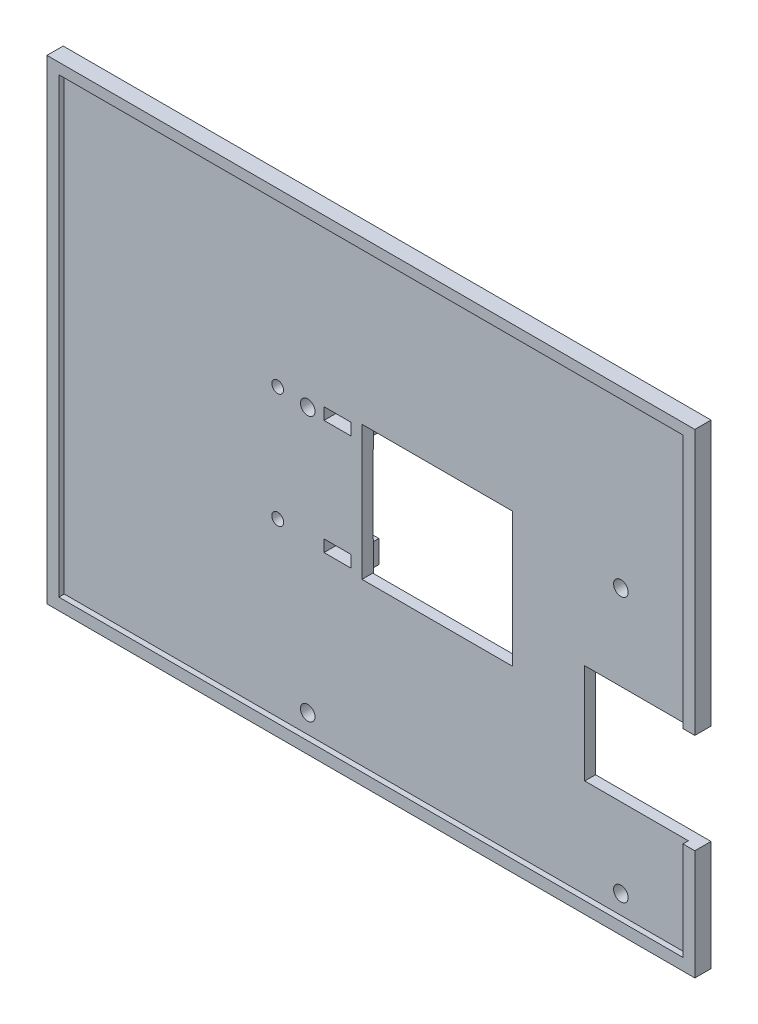
from build123d import *

# Parameters (mm, degrees)
SKETCH_1_W          = 120
SKETCH_1_H          = 80
EXTRUDE_1_DEPTH     = 38
SKETCH_3_W          = 117.6
SKETCH_3_H          = 77.6
CUT_EXTRUDE_1_DEPTH = 36
SKETCH_4_W          = 25.152970524
SKETCH_4_H          = 18.492901276
CUT_EXTRUDE_2_DEPTH = 10
SKETCH_7_W          = 17.413678367
SKETCH_7_H          = 5.076618726
SKETCH_7_H_2        = 5.541721388
EXTRUDE_2_DEPTH     = 0.1
SKETCH_9_W          = 27.882777132
SKETCH_9_H          = 24.878568111
CUT_EXTRUDE_4_DEPTH = 12
SKETCH_12_R         = 1.085209003
SKETCH_12_R_2       = 1.1
SKETCH_12_W         = 5.025
SKETCH_12_H         = 2.2
CUT_EXTRUDE_5_DEPTH = 12
SKETCH_13_R         = 1.35
CUT_EXTRUDE_6_DEPTH = 12
SKETCH_14_W         = 117.6
SKETCH_14_H         = 36
CUT_EXTRUDE_7_DEPTH = 10
EXTRUDE_3_DEPTH     = 5
SKETCH_16_W         = 120
SKETCH_16_H         = 38
EXTRUDE_4_DEPTH     = 2
SKETCH_17_W         = 36
SKETCH_17_H         = 83.8
EXTRUDE_5_DEPTH     = 1
EXTRUDE_6_DEPTH     = 1
SKETCH_19_W         = 120
SKETCH_19_H         = 38
EXTRUDE_7_DEPTH     = 1
EXTRUDE_START       = 2
SKETCH_20_R         = 2
SKETCH_20_R_2       = 1.085209003
SKETCH_20_R_3       = 2.001649737
SKETCH_20_R_4       = 1.1
SKETCH_20_W         = 7.2
SKETCH_20_H         = 4.2
SKETCH_20_W_2       = 5.025
SKETCH_20_H_2       = 2.2
EXTRUDE_8_DEPTH     = 2
SKETCH_22_W         = 120
SKETCH_22_H         = 88
CUT_EXTRUDE_8_DEPTH = 35


with BuildPart() as part:
    # 草图1 → 凸台-拉伸1 (new body)
    with BuildSketch(Plane.XY):
        with Locations((-463.106796117, 303.186737633)):
            Rectangle(SKETCH_1_W, SKETCH_1_H)
    extrude(amount=EXTRUDE_1_DEPTH)

    # 草图3 → 切除-拉伸1 (cut)
    with BuildSketch(Plane.XY.offset(38)):
        with Locations((-463.106796117, 303.186737633)):
            Rectangle(SKETCH_3_W, SKETCH_3_H)
    extrude(amount=-CUT_EXTRUDE_1_DEPTH, mode=Mode.SUBTRACT)

    # 草图4 → 切除-拉伸2 (cut)
    with BuildSketch(Plane(origin=(0, 0, 0), x_dir=(-1, 0, 0), z_dir=(0, 0, -1))):
        with Locations((411.924701676, 291.841861287)):
            Rectangle(SKETCH_4_W, SKETCH_4_H)
    extrude(amount=-CUT_EXTRUDE_2_DEPTH, mode=Mode.SUBTRACT)

    # 草图7 → 凸台-拉伸2 (add)
    with BuildSketch(Plane(origin=(0, 0, 0), x_dir=(-1, 0, 0), z_dir=(0, 0, -1))):
        with Locations((474.461956934, 316.64842827)):
            Rectangle(SKETCH_7_W, SKETCH_7_H)
        with Locations((474.461956934, 296.957598327)):
            Rectangle(SKETCH_7_W, SKETCH_7_H_2)
    extrude(amount=EXTRUDE_2_DEPTH)

    # 草图9 → 切除-拉伸4 (cut)
    with BuildSketch(Plane(origin=(0, 0, 0), x_dir=(-1, 0, 0), z_dir=(0, 0, -1))):
        with Locations((451.813729184, 306.747453577)):
            Rectangle(SKETCH_9_W, SKETCH_9_H)
    extrude(amount=-CUT_EXTRUDE_4_DEPTH, mode=Mode.SUBTRACT)

    # 草图12 → 切除-拉伸5 (cut)
    with BuildSketch(Plane(origin=(0, 0, -0.1), x_dir=(-1, 0, 0), z_dir=(0, 0, -1))):
        with Locations((481.368796117, 317.386737633)):
            Circle(SKETCH_12_R)
        with Locations((481.368796117, 296.186737633)):
            Circle(SKETCH_12_R_2)
        with Locations((470.281296117, 317.386737633)):
            Rectangle(SKETCH_12_W, SKETCH_12_H)
        with Locations((470.281296117, 296.186737633)):
            Rectangle(SKETCH_12_W, SKETCH_12_H)
    extrude(amount=-CUT_EXTRUDE_5_DEPTH, mode=Mode.SUBTRACT)

    # 草图13 → 切除-拉伸6 (cut)
    with BuildSketch(Plane.XY.offset(2)):
        with Locations((-475.806796117, 316.886737633)):
            Circle(SKETCH_13_R)
        with Locations((-417.806796117, 316.886737633)):
            Circle(SKETCH_13_R)
        with Locations((-417.806796117, 267.886737633)):
            Circle(SKETCH_13_R)
        with Locations((-475.806796117, 267.886737633)):
            Circle(SKETCH_13_R)
    extrude(amount=-CUT_EXTRUDE_6_DEPTH, mode=Mode.SUBTRACT)

    # 草图14 → 切除-拉伸7 (cut)
    with BuildSketch(Plane.XZ.offset(-341.986737633)):
        with Locations((-463.106796117, 20)):
            Rectangle(SKETCH_14_W, SKETCH_14_H)
    extrude(amount=-CUT_EXTRUDE_7_DEPTH, mode=Mode.SUBTRACT)

    # 草图15 → 凸台-拉伸3 (add)
    with BuildSketch(Plane(origin=(0, 343.186737633, 0), x_dir=(1, 0, 0), z_dir=(0, 1, 0))):
        Polygon((-521.906796117, -2), (-404.306796117, -2), (-404.306796117, -38), (-403.106796117, -38), (-403.106796117, 0), (-523.106796117, 0), (-523.106796117, -38), (-521.906796117, -38), align=None)
    extrude(amount=EXTRUDE_3_DEPTH)

    # 草图16 → 凸台-拉伸4 (add)
    with BuildSketch(Plane(origin=(0, 348.186737633, 0), x_dir=(1, 0, 0), z_dir=(0, 1, 0))):
        with Locations((-463.106796117, -19)):
            Rectangle(SKETCH_16_W, SKETCH_16_H)
    extrude(amount=EXTRUDE_4_DEPTH)

    # 草图17 → 凸台-拉伸5 (add)
    with BuildSketch(Plane(origin=(-521.906796117, 0, 0), x_dir=(0, 0, -1), z_dir=(1, 0, 0))):
        with Locations((-20, 306.286737633)):
            Rectangle(SKETCH_17_W, SKETCH_17_H)
    extrude(amount=EXTRUDE_5_DEPTH)

    # 草图18 → 凸台-拉伸6 (add)
    with BuildSketch(Plane.ZY.offset(404.306796117)):
        Polygon((10, 301.088311925), (10, 282.595410649), (2, 282.595410649), (2, 264.386737633), (38, 264.386737633), (38, 348.186737633), (2, 348.186737633), (2, 301.088311925), align=None)
    extrude(amount=EXTRUDE_6_DEPTH)

    # 草图19 → 凸台-拉伸7 (add)
    with BuildSketch(Plane.XZ.offset(-263.186737633)):
        with Locations((-463.106796117, 19)):
            Rectangle(SKETCH_19_W, SKETCH_19_H)
    extrude(amount=EXTRUDE_7_DEPTH)

    # 草图20 → 凸台-拉伸8 (add)
    # profile 1 of 4: a face of its own
    with BuildSketch(Plane(origin=(0, 0, -0.1), x_dir=(-1, 0, 0), z_dir=(0, 0, -1)).offset(EXTRUDE_START)):
        with Locations(Location((481.368796117, 317.386737633, 0), (0, 0, 115.841932763))):
            Circle(SKETCH_20_R)
        with Locations((481.368796117, 317.386737633)):
            Circle(SKETCH_20_R_2, mode=Mode.SUBTRACT)
    # profile 2 of 4: a face of its own
    with BuildSketch(Plane(origin=(0, 0, -0.1), x_dir=(-1, 0, 0), z_dir=(0, 0, -1)).offset(EXTRUDE_START)):
        with Locations(Location((481.368796117, 296.186737633, 0), (0, 0, 267.673619076))):
            Circle(SKETCH_20_R_3)
        with Locations((481.368796117, 296.186737633)):
            Circle(SKETCH_20_R_4, mode=Mode.SUBTRACT)
    # profile 3 of 4: a face of its own
    with BuildSketch(Plane(origin=(0, 0, -0.1), x_dir=(-1, 0, 0), z_dir=(0, 0, -1)).offset(EXTRUDE_START)):
        with Locations((470.395177276, 317.386737633)):
            Rectangle(SKETCH_20_W, SKETCH_20_H)
        with Locations((470.281296117, 317.386737633)):
            Rectangle(SKETCH_20_W_2, SKETCH_20_H_2, mode=Mode.SUBTRACT)
    # profile 4 of 4: a face of its own
    with BuildSketch(Plane(origin=(0, 0, -0.1), x_dir=(-1, 0, 0), z_dir=(0, 0, -1)).offset(EXTRUDE_START)):
        with Locations((470.325427447, 296.233937818)):
            Rectangle(SKETCH_20_W, SKETCH_20_H)
        with Locations((470.281296117, 296.186737633)):
            Rectangle(SKETCH_20_W_2, SKETCH_20_H_2, mode=Mode.SUBTRACT)
    extrude(amount=-EXTRUDE_8_DEPTH)

    # 草图22 → 切除-拉伸8 (cut)
    with BuildSketch(Plane.XY.offset(38)):
        with Locations((-463.106796117, 306.186737633)):
            Rectangle(SKETCH_22_W, SKETCH_22_H)
    extrude(amount=-CUT_EXTRUDE_8_DEPTH, mode=Mode.SUBTRACT)


solid = part.part
